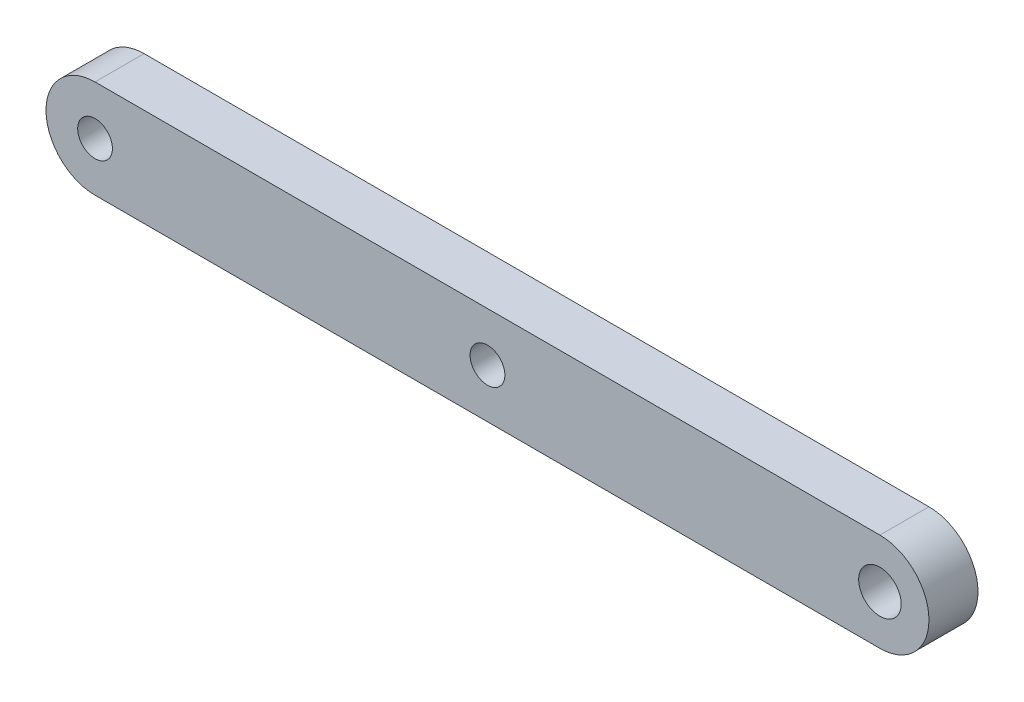
from build123d import *

# Parameters (mm, degrees)
BOSS_EXTRUDE1_DEPTH  = 6.35
M5_CLEARANCE_HOLE1_D = 5.5
M4_CLEARANCE_HOLE1_D = 4.5


with BuildPart() as part:
    # Sketch1 → Boss-Extrude1 (new body)
    with BuildSketch(Plane.XY):
        with BuildLine():
            Line((0, 6.35), (101.6, 6.35))
            ThreePointArc((101.6, 6.35), (107.95, 0), (101.6, -6.35))
            Line((101.6, -6.35), (0, -6.35))
            ThreePointArc((0, -6.35), (-6.35, 0), (0, 6.35))
        make_face()
    extrude(amount=BOSS_EXTRUDE1_DEPTH)

    # M5 Clearance Hole1 (through all)
    with Locations(Plane(origin=(0, 0, 0), x_dir=(-1, 0, 0), z_dir=(0, 0, -1))):
        with Locations((-101.6, 0)):
            Hole(M5_CLEARANCE_HOLE1_D / 2)

    # M4 Clearance Hole1 (through all)
    with Locations(Plane(origin=(0, 0, 0), x_dir=(-1, 0, 0), z_dir=(0, 0, -1))):
        with Locations((-50.8, 0), (0, 0)):
            Hole(M4_CLEARANCE_HOLE1_D / 2)


solid = part.part
